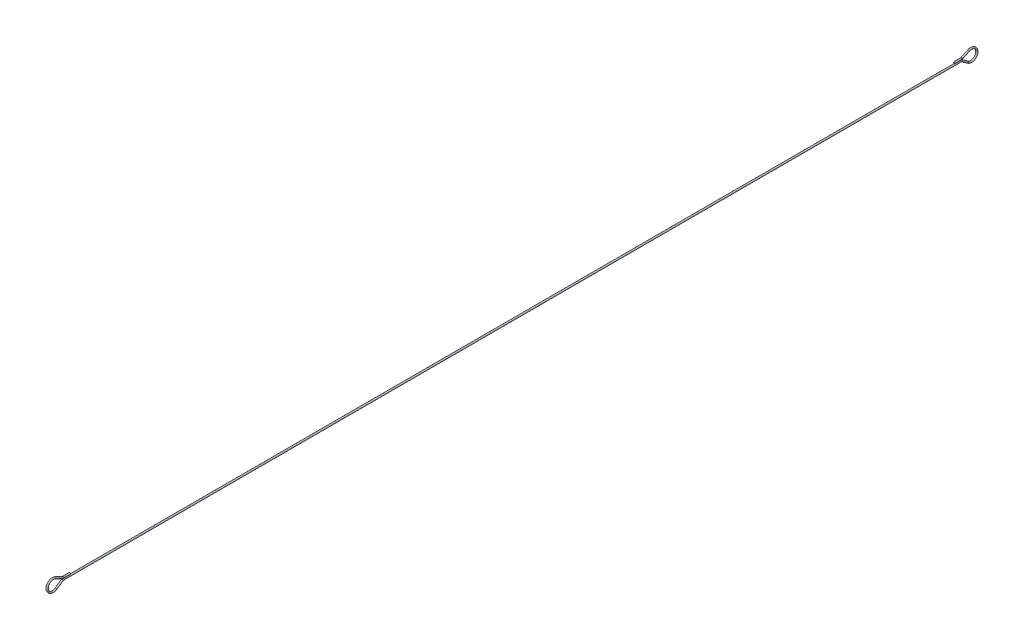
from build123d import *

# Parameters (mm, degrees)
SKETCH2_R = 1.5875


with BuildPart() as part:
    # Sweep1: sweep along a path in Sketch1
    with BuildLine(Plane(origin=(0, 0, 0), x_dir=(0, 0, -1), z_dir=(1, 0, 0))) as sweep1_path:
        Line((0, 0), (-882.689079714, 0))
        ThreePointArc((-882.689079714, 0), (-883.638359511, -0.145232209), (-884.500794583, -0.567642289))
        Line((-884.500794583, -0.567642289), (-896.889573308, -9.175948905))
        ThreePointArc((-896.889573308, -9.175948905), (-914.4, -0.933700659), (-898.506790289, 10.109649564))
        Line((-898.506790289, 10.109649564), (-884.857388714, 3.684805775))
        ThreePointArc((-884.857388714, 3.684805775), (-883.800002816, 3.322679475), (-882.689079714, 3.2))
        Line((-882.689079714, 3.2), (-869.989079714, 3.2))
    # Sketch2 → Sweep1 (sweep)
    with BuildSketch(Plane.XY):
        Circle(SKETCH2_R)
    sweep1 = sweep(path=sweep1_path.line)

    # Mirror1: Sweep1 across plane
    add(sweep1.mirror(Plane.XY))


solid = part.part
